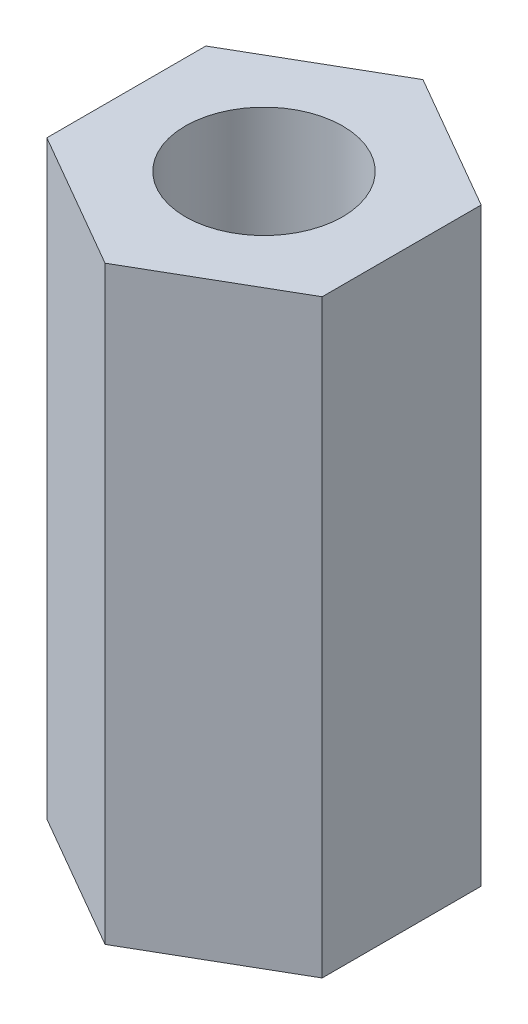
from build123d import *

# Parameters (mm, degrees)
IZIM1_R                     = 2
Y_KSEKLIK_EKSTR_ZYON1_DEPTH = 15


with BuildPart() as part:
    # Çizim1 → Yükseklik-Ekstrüzyon1 (new body)
    with BuildSketch(Plane(origin=(0, 0, 0), x_dir=(1, 0, 0), z_dir=(0, 1, 0))):
        Polygon((3.5, 2.020725942), (0, 4.041451884), (-3.5, 2.020725942), (-3.5, -2.020725942), (0, -4.041451884), (3.5, -2.020725942), align=None)
        with Locations(Location((0, 0, 0), (0, 0, 270))):
            Circle(IZIM1_R, mode=Mode.SUBTRACT)
    extrude(amount=Y_KSEKLIK_EKSTR_ZYON1_DEPTH)


solid = part.part
